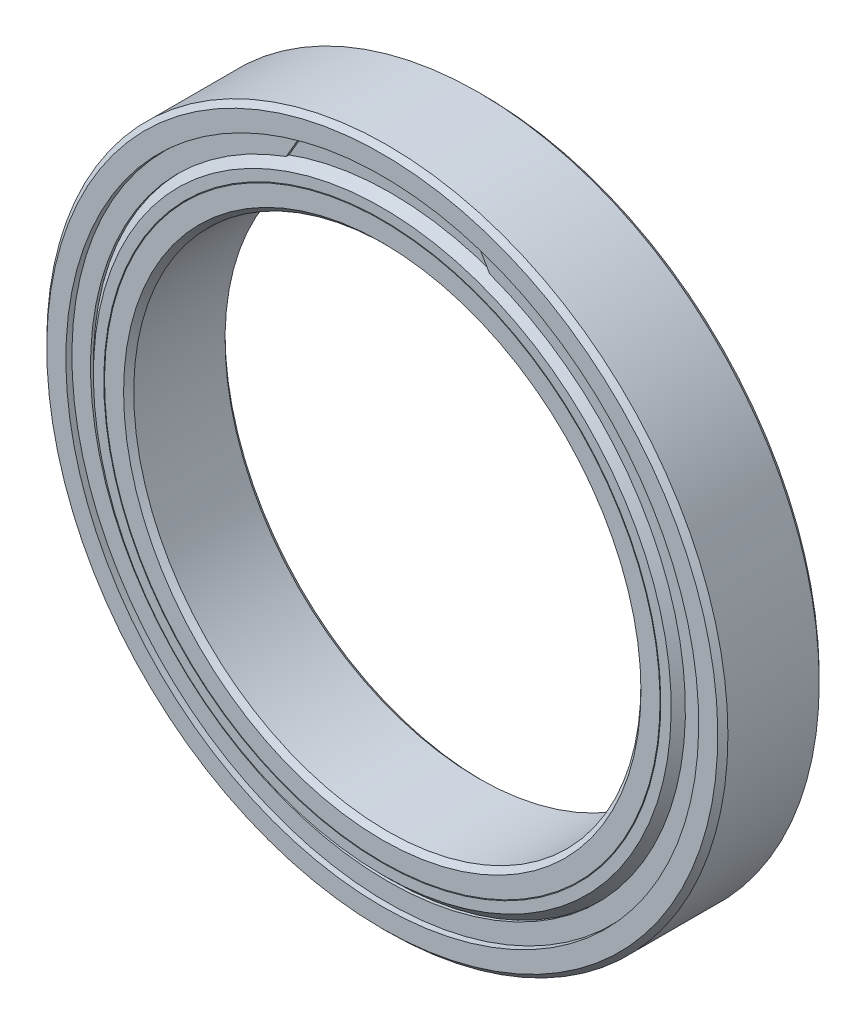
from build123d import *

# Parameters (mm, degrees)
SKETCH5_W           = 0.381
SKETCH5_H           = 1.282533333
BOSS_EXTRUDE1_DEPTH = 0.2
CIRPATTERN1_COUNT   = 17


with BuildPart() as part:
    # Sketch5 → Revolve1 (revolve)
    with BuildSketch(Plane(origin=(0, 0, 0), x_dir=(0, 0, -1), z_dir=(1, 0, 0))):
        with BuildLine():
            Line((3.15, 23.5), (-3.15, 23.5))
            Line((-3.15, 23.5), (-3.5, 23.15))
            Line((-3.5, 23.15), (-3.5, 21.833333333))
            Line((-3.5, 21.833333333), (-1.555555556, 21.833333333))
            ThreePointArc((-1.555555556, 21.833333333), (0, 22.548787657), (1.555555556, 21.833333333))
            Line((1.555555556, 21.833333333), (3.5, 21.833333333))
            Line((3.5, 21.833333333), (3.5, 23.15))
            Line((3.5, 23.15), (3.15, 23.5))
        make_face()
        with Locations((2.71864421, 21.166666666)):
            Rectangle(SKETCH5_W, SKETCH5_H)
        with Locations((-2.71864421, 21.166666666)):
            Rectangle(SKETCH5_W, SKETCH5_H)
    revolve(axis=Axis((0, 0, 3.5), (0, 0, -1)))


with BuildPart() as body_2:
    # Sketch3 → Revolve3 (revolve)
    with BuildSketch(Plane(origin=(0, 0, 0), x_dir=(0, 0, -1), z_dir=(1, 0, 0))):
        with BuildLine():
            Line((-3.5, 19.166666667), (-1.555555556, 19.166666667))
            ThreePointArc((-1.555555556, 19.166666667), (0, 18.451212343), (1.555555556, 19.166666667))
            Line((1.555555556, 19.166666667), (3.5, 19.166666667))
            Line((3.5, 19.166666667), (3.5, 17.85))
            Line((3.5, 17.85), (3.15, 17.5))
            Line((3.15, 17.5), (-3.15, 17.5))
            Line((-3.15, 17.5), (-3.5, 17.85))
            Line((-3.5, 17.85), (-3.5, 19.166666667))
        make_face()
    revolve(axis=Axis((0, 0, 3.5), (0, 0, -1)))


with BuildPart() as body_3:
    # Sketch9 → Revolve5 (revolve)
    with BuildSketch(Plane(origin=(0, 0, 0), x_dir=(0, 0, -1), z_dir=(1, 0, 0))):
        Polygon((-2.90914421, 20.5254), (-3.5, 19.93454421), (-3.5, 19.216666667), (-2.52814421, 19.216666667), (-2.52814421, 20.5254), align=None)
        Polygon((2.90914421, 20.5254), (2.52814421, 20.5254), (2.52814421, 19.216666667), (3.5, 19.216666667), (3.5, 19.93454421), align=None)
    revolve(axis=Axis((0, 0, 3.5), (0, 0, -1)))


with BuildPart() as body_4:
    # Sketch10 → Boss-Extrude1 (new body)
    with BuildSketch(Plane.XY.offset(2.90914421)):
        with BuildLine():
            Line((-7.02010025, 19.287566919), (-6.061017111, 20.948747644))
            ThreePointArc((-6.061017111, 20.948747644), (0, -21.807933333), (6.061017111, 20.948747644))
            Line((6.061017111, 20.948747644), (7.02010025, 19.287566919))
            ThreePointArc((7.02010025, 19.287566919), (0, -20.5254), (-7.02010025, 19.287566919))
        make_face()
    extrude(amount=BOSS_EXTRUDE1_DEPTH)


with BuildPart() as body_5:
    # Mirror2: mirrored copy
    add(body_4.part.mirror(Plane.XY))


with BuildPart() as body_6:
    # Sketch4 → Revolve4 (revolve)
    with BuildSketch(Plane(origin=(0, 0, 0), x_dir=(0, 0, -1), z_dir=(1, 0, 0))):
        with BuildLine():
            Line((-2.048787657, 20.5), (2.048787657, 20.5))
            ThreePointArc((2.048787657, 20.5), (0, 22.548787657), (-2.048787657, 20.5))
        make_face()
    revolve(axis=Axis((0, 20.5, 2.048787657), (0, 0, -1)))


with BuildPart() as cirpattern1_1:
    # CirPattern1: pattern copy
    add(body_6.part.rotate(Axis((0, 0, 0), (0, 0, 1)), 1 * 360 / CIRPATTERN1_COUNT))


with BuildPart() as cirpattern1_2:
    # CirPattern1: pattern copy
    add(body_6.part.rotate(Axis((0, 0, 0), (0, 0, 1)), 2 * 360 / CIRPATTERN1_COUNT))


with BuildPart() as cirpattern1_3:
    # CirPattern1: pattern copy
    add(body_6.part.rotate(Axis((0, 0, 0), (0, 0, 1)), 3 * 360 / CIRPATTERN1_COUNT))


with BuildPart() as cirpattern1_4:
    # CirPattern1: pattern copy
    add(body_6.part.rotate(Axis((0, 0, 0), (0, 0, 1)), 4 * 360 / CIRPATTERN1_COUNT))


with BuildPart() as cirpattern1_5:
    # CirPattern1: pattern copy
    add(body_6.part.rotate(Axis((0, 0, 0), (0, 0, 1)), 5 * 360 / CIRPATTERN1_COUNT))


with BuildPart() as cirpattern1_6:
    # CirPattern1: pattern copy
    add(body_6.part.rotate(Axis((0, 0, 0), (0, 0, 1)), 6 * 360 / CIRPATTERN1_COUNT))


with BuildPart() as cirpattern1_7:
    # CirPattern1: pattern copy
    add(body_6.part.rotate(Axis((0, 0, 0), (0, 0, 1)), 7 * 360 / CIRPATTERN1_COUNT))


with BuildPart() as cirpattern1_8:
    # CirPattern1: pattern copy
    add(body_6.part.rotate(Axis((0, 0, 0), (0, 0, 1)), 8 * 360 / CIRPATTERN1_COUNT))


with BuildPart() as cirpattern1_9:
    # CirPattern1: pattern copy
    add(body_6.part.rotate(Axis((0, 0, 0), (0, 0, 1)), 9 * 360 / CIRPATTERN1_COUNT))


with BuildPart() as cirpattern1_10:
    # CirPattern1: pattern copy
    add(body_6.part.rotate(Axis((0, 0, 0), (0, 0, 1)), 10 * 360 / CIRPATTERN1_COUNT))


with BuildPart() as cirpattern1_11:
    # CirPattern1: pattern copy
    add(body_6.part.rotate(Axis((0, 0, 0), (0, 0, 1)), 11 * 360 / CIRPATTERN1_COUNT))


with BuildPart() as cirpattern1_12:
    # CirPattern1: pattern copy
    add(body_6.part.rotate(Axis((0, 0, 0), (0, 0, 1)), 12 * 360 / CIRPATTERN1_COUNT))


with BuildPart() as cirpattern1_13:
    # CirPattern1: pattern copy
    add(body_6.part.rotate(Axis((0, 0, 0), (0, 0, 1)), 13 * 360 / CIRPATTERN1_COUNT))


with BuildPart() as cirpattern1_14:
    # CirPattern1: pattern copy
    add(body_6.part.rotate(Axis((0, 0, 0), (0, 0, 1)), 14 * 360 / CIRPATTERN1_COUNT))


with BuildPart() as cirpattern1_15:
    # CirPattern1: pattern copy
    add(body_6.part.rotate(Axis((0, 0, 0), (0, 0, 1)), 15 * 360 / CIRPATTERN1_COUNT))


with BuildPart() as cirpattern1_16:
    # CirPattern1: pattern copy
    add(body_6.part.rotate(Axis((0, 0, 0), (0, 0, 1)), 16 * 360 / CIRPATTERN1_COUNT))


solid = Compound([part.part, body_2.part, body_3.part, body_4.part, body_5.part, body_6.part, cirpattern1_1.part, cirpattern1_2.part, cirpattern1_3.part, cirpattern1_4.part, cirpattern1_5.part, cirpattern1_6.part, cirpattern1_7.part, cirpattern1_8.part, cirpattern1_9.part, cirpattern1_10.part, cirpattern1_11.part, cirpattern1_12.part, cirpattern1_13.part, cirpattern1_14.part, cirpattern1_15.part, cirpattern1_16.part])
